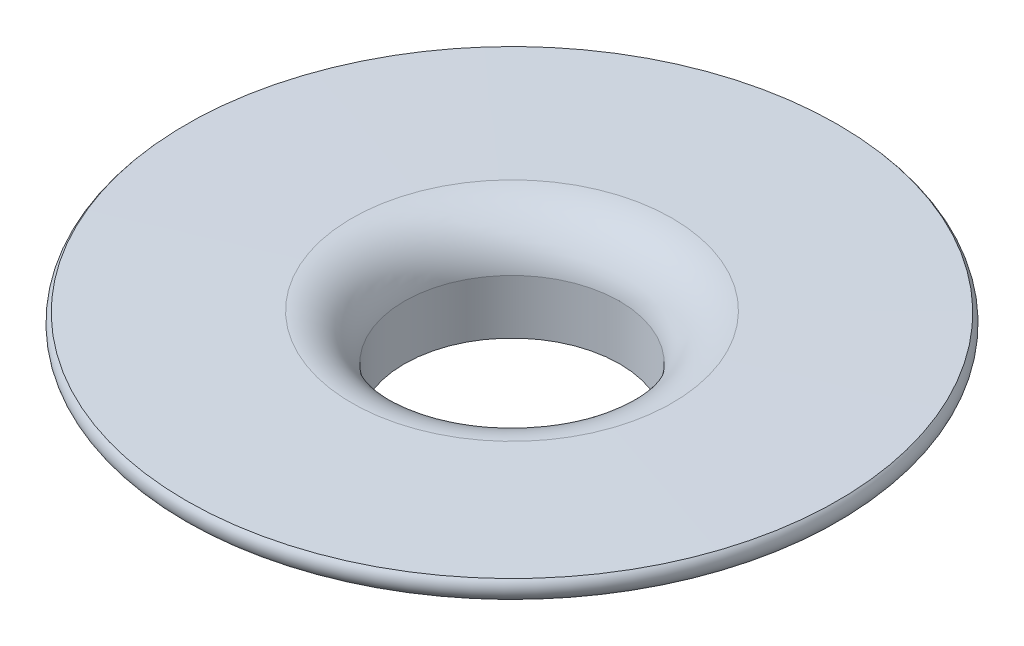
from build123d import *


with BuildPart() as part:
    # Sketch1 → Revolve1 (revolve)
    with BuildSketch(Plane(origin=(0, 0, 0), x_dir=(0, 0, -1), z_dir=(1, 0, 0)), mode=Mode.PRIVATE) as revolve1_sk:
        with BuildLine():
            Line((-18, -1.25), (-8.75, -1.25))
            ThreePointArc((-8.75, -1.25), (-7.600097578, -1.650784896), (-6.94842599, -2.679487115))
            Line((-6.94842599, -2.679487115), (-6.94842599, -5.679487115))
            Line((-6.94842599, -5.679487115), (-5.949317187, -5.679487115))
            Line((-5.949317187, -5.679487115), (-5.949317187, -2.679487115))
            ThreePointArc((-5.949317187, -2.679487115), (-6.941628239, -0.893587174), (-8.847382379, -0.157230615))
            Line((-8.847382379, -0.157230615), (-18, -0.25))
            ThreePointArc((-18, -0.25), (-18.207106781, -0.75), (-18, -1.25))
        make_face()
    revolve(revolve1_sk.sketch.rotate(Axis((0, -237.677688504, 0), (0, 1, 0)), 180), axis=Axis((0, -237.677688504, 0), (0, 1, 0)))


solid = part.part
